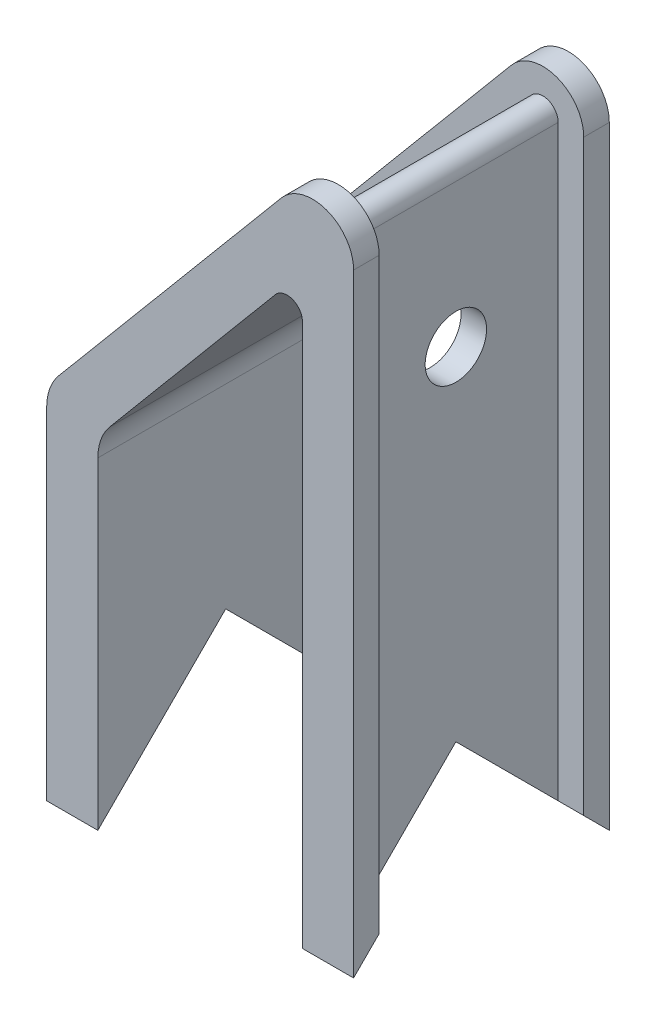
from build123d import *

# Parameters (mm, degrees)
BOSS_EXTRUDE2_DEPTH = 50
CUT_EXTRUDE1_REACH  = 175.469
SKETCH2_W           = 5
SKETCH2_H           = 40
SKETCH3_W           = 40
SKETCH3_H           = 5
CUT_EXTRUDE4_DEPTH  = 25
CUT_EXTRUDE5_REACH  = 148.615
SKETCH5_W           = 40
SKETCH5_H           = 5
CUT_EXTRUDE6_REACH  = 175.469
SKETCH6_W           = 5
SKETCH6_H           = 40
FILLET1_R           = 10
FILLET2_R           = 3
FILLET3_R           = 8
CUT_EXTRUDE7_REACH  = 146.893
CUT_EXTRUDE8_DEPTH  = 145.893467036
SKETCH10_W          = 50
SKETCH10_H          = 14.886309014
CUT_EXTRUDE9_DEPTH  = 145.893467036
CUT_EXTRUDE10_REACH = 110.938
SKETCH11_R          = 6
CUT_EXTRUDE11_REACH = 144.895
SKETCH12_R          = 6


with BuildPart() as part:
    # Sketch1 → Boss-Extrude2 (new body)
    with BuildSketch(Plane.XY):
        Polygon((5, -20.716112532), (5, 136.021274565), (-55, 64.51605901), (-55, -20.716112532), (-45, -20.716112532), (-45, 60.876356667), (-5, 108.546500371), (-5, -20.716112532), align=None)
    extrude(amount=BOSS_EXTRUDE2_DEPTH)

    # Cut-Extrude1: up to this plane
    cut_extrude1_end = Plane(origin=(5, 136.021274565, 50), z_dir=(0.7660444431189773, -0.6427876096865403, 0))
    # Sketch2 → Cut-Extrude1 (cut, up to the surface)
    with BuildSketch(Plane.XZ.offset(20.716112532), mode=Mode.PRIVATE) as cut_extrude1_sk1:
        with Locations((-52.5, 25)):
            Rectangle(SKETCH2_W, SKETCH2_H)
    cut_extrude1_tool1 = split(extrude(cut_extrude1_sk1.sketch, amount=-CUT_EXTRUDE1_REACH, mode=Mode.PRIVATE), bisect_by=cut_extrude1_end, keep=Keep.BOTH, mode=Mode.PRIVATE)
    add(cut_extrude1_tool1.solids().sort_by_distance((-52.5, -20.716113, 25))[0], mode=Mode.SUBTRACT)

    # Sketch3 → Cut-Extrude4 (cut)
    with BuildSketch(Plane(origin=(14.043282439, 16.736132299, 0), x_dir=(0, 0, -1), z_dir=(0.6427876096865403, 0.7660444431189773, 0))):
        with Locations((-25, 81.102567729)):
            Rectangle(SKETCH3_W, SKETCH3_H)
    extrude(amount=-CUT_EXTRUDE4_DEPTH, mode=Mode.SUBTRACT)

    # Cut-Extrude5: up to this plane
    cut_extrude5_end = Plane(origin=(5, -20.716112532, 50), z_dir=(-1, 0, 0))
    # Sketch5 → Cut-Extrude5 (cut, up to the surface)
    with BuildSketch(Plane(origin=(14.043282439, 16.736132299, 0), x_dir=(0, 0, -1), z_dir=(0.6427876096865403, 0.7660444431189773, 0)), mode=Mode.PRIVATE) as cut_extrude5_sk1:
        with Locations((-25, 81.102567729)):
            Rectangle(SKETCH5_W, SKETCH5_H)
    cut_extrude5_tool1 = split(extrude(cut_extrude5_sk1.sketch, amount=CUT_EXTRUDE5_REACH, mode=Mode.PRIVATE), bisect_by=cut_extrude5_end, keep=Keep.BOTH, mode=Mode.PRIVATE)
    add(cut_extrude5_tool1.solids().sort_by_distance((-48.084889, 68.867858, 25))[0], mode=Mode.SUBTRACT)

    # Cut-Extrude6: up to this plane
    cut_extrude6_end = Plane(origin=(-62.239468027, 48.109777846, 45), z_dir=(0.7660444431189773, -0.6427876096865403, 0))
    # Sketch6 → Cut-Extrude6 (cut, up to the surface)
    with BuildSketch(Plane.XZ.offset(20.716112532), mode=Mode.PRIVATE) as cut_extrude6_sk1:
        with Locations((2.5, 25)):
            Rectangle(SKETCH6_W, SKETCH6_H)
    cut_extrude6_tool1 = split(extrude(cut_extrude6_sk1.sketch, amount=-CUT_EXTRUDE6_REACH, mode=Mode.PRIVATE), bisect_by=cut_extrude6_end, keep=Keep.BOTH, mode=Mode.PRIVATE)
    add(cut_extrude6_tool1.solids().sort_by_distance((2.5, -20.716113, 25))[0], mode=Mode.SUBTRACT)

    # Fillet1
    fillet1_edges = [part.edges().sort_by_distance(p)[0] for p in [
        (-45, 60.876356667, 25),
        (-55, 64.51605901, 47.5),
        (-55, 64.51605901, 2.5),
        (-50, 62.696207838, 25),
    ]]
    fillet(fillet1_edges, radius=FILLET1_R)

    # Fillet2
    fillet2_edges = [part.edges().sort_by_distance(p)[0] for p in [
        (-5, 108.546500371, 25),
        (0, 122.283887468, 25),
    ]]
    fillet(fillet2_edges, radius=FILLET2_R)

    # Fillet3
    fillet3_edges = [part.edges().sort_by_distance(p)[0] for p in [
        (5, 136.021274565, 47.5),
        (5, 136.021274565, 2.5),
    ]]
    fillet(fillet3_edges, radius=FILLET3_R)

    # Cut-Extrude7: up to this face of the body (flat: up to its plane)
    cut_extrude7_end = Plane(part.part.faces().sort_by_distance((5, 46.662671339, 2.5))[0])
    # Sketch8 → Cut-Extrude7 (cut, up to the picked face)
    with BuildSketch(Plane.ZY.offset(55), mode=Mode.PRIVATE) as cut_extrude7_sk1:
        Polygon((0, -20.716112532), (25, 19.170196482), (50, -20.716112532), align=None)
    cut_extrude7_tool1 = split(extrude(cut_extrude7_sk1.sketch, amount=-CUT_EXTRUDE7_REACH, mode=Mode.PRIVATE), bisect_by=cut_extrude7_end, keep=Keep.BOTH, mode=Mode.PRIVATE)
    add(cut_extrude7_tool1.solids().sort_by(Axis((-55, -7.420676, 25), (1, 0, 0)))[0], mode=Mode.SUBTRACT)

    # Sketch9 → Cut-Extrude8 (cut, through all)
    with BuildSketch(Plane(origin=(5, 0, 0), x_dir=(0, 0, -1), z_dir=(1, 0, 0))):
        Polygon((0, -5.829803518), (-25, 19.170196482), (-50, -5.829803518), align=None)
    extrude(amount=-CUT_EXTRUDE8_DEPTH, mode=Mode.SUBTRACT)


with BuildPart() as cut_extrude8_piece_1:
    # of the separate pieces the step leaves, piece 1, a body of its own (cut_extrude8_pieces)
    add(part.part.solids().sort_by_distance((-5, 100.304068112, 0))[0])

    # Sketch11 → Cut-Extrude10 (cut, up to next)
    with BuildSketch(Plane(origin=(-60.213060223, 50.524756626, 0), x_dir=(0, 0, 1), z_dir=(-0.7660444431189772, 0.6427876096865404, 0)), mode=Mode.PRIVATE) as cut_extrude10_sk1:
        with Locations(Location((25, 55.43246022, 0), (0, 0, 270))):
            Circle(SKETCH11_R)
    cut_extrude10_tool1 = extrude(cut_extrude10_sk1.sketch, amount=-CUT_EXTRUDE10_REACH, mode=Mode.PRIVATE) & cut_extrude8_piece_1.part
    add(cut_extrude10_tool1.solids().sort_by_distance((-24.581762, 92.988485, 25))[0], mode=Mode.SUBTRACT)

    # Sketch12 → Cut-Extrude11 (cut, up to next)
    with BuildSketch(Plane(origin=(0, 0, 0), x_dir=(0, 0, -1), z_dir=(1, 0, 0)), mode=Mode.PRIVATE) as cut_extrude11_sk1:
        with Locations((-25, 86.04145521)):
            Circle(SKETCH12_R)
    cut_extrude11_tool1 = extrude(cut_extrude11_sk1.sketch, amount=-CUT_EXTRUDE11_REACH, mode=Mode.PRIVATE) & cut_extrude8_piece_1.part
    add(cut_extrude11_tool1.solids().sort_by_distance((0, 86.041455, 25))[0], mode=Mode.SUBTRACT)


with BuildPart() as cut_extrude8_piece_2:
    # of the separate pieces the step leaves, piece 2, a body of its own (cut_extrude8_pieces)
    add(part.part.solids().sort_by_distance((-5, -20.716112532, 0))[0])


with BuildPart() as cut_extrude8_piece_3:
    # of the separate pieces the step leaves, piece 3, a body of its own (cut_extrude8_pieces)
    add(part.part.solids().sort_by_distance((-45, -20.716112532, 0))[0])


with BuildPart() as cut_extrude8_piece_4:
    # of the separate pieces the step leaves, piece 4, a body of its own (cut_extrude8_pieces)
    add(part.part.solids().sort_by_distance((-5, -20.716112532, 50))[0])


with BuildPart() as cut_extrude8_piece_5:
    # of the separate pieces the step leaves, piece 5, a body of its own (cut_extrude8_pieces)
    add(part.part.solids().sort_by_distance((-45, -20.716112532, 50))[0])


with BuildPart() as cut_extrude9_tool:
    # Sketch10 → Cut-Extrude9 (new, through all)
    with BuildSketch(Plane.ZY.offset(55)):
        with Locations((25, -13.272958025)):
            Rectangle(SKETCH10_W, SKETCH10_H)
    extrude(amount=-CUT_EXTRUDE9_DEPTH)


with BuildPart() as cut_extrude8_piece_2_1:
    add(cut_extrude8_piece_2.part)

    # Cut-Extrude9: cut by cut_extrude9_tool
    add(cut_extrude9_tool.part, mode=Mode.SUBTRACT)


with BuildPart() as cut_extrude8_piece_3_1:
    add(cut_extrude8_piece_3.part)

    # Cut-Extrude9: cut by cut_extrude9_tool
    add(cut_extrude9_tool.part, mode=Mode.SUBTRACT)


with BuildPart() as cut_extrude8_piece_4_1:
    add(cut_extrude8_piece_4.part)

    # Cut-Extrude9: cut by cut_extrude9_tool
    add(cut_extrude9_tool.part, mode=Mode.SUBTRACT)


with BuildPart() as cut_extrude8_piece_5_1:
    add(cut_extrude8_piece_5.part)

    # Cut-Extrude9: cut by cut_extrude9_tool
    add(cut_extrude9_tool.part, mode=Mode.SUBTRACT)


solid = cut_extrude8_piece_1.part
